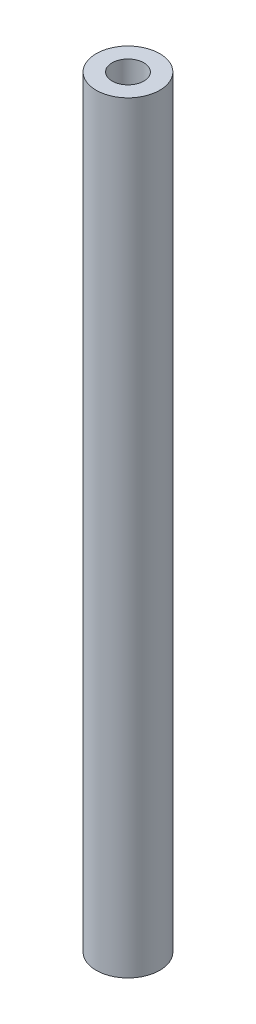
from build123d import *

# Parameters (mm, degrees)
CROQUIS_BASE_R          = 2.5
SALIENTE_EXTRUIR1_DEPTH = 60
CROQUIS_BARRENO_R       = 1.25
CORTAR_EXTRUIR1_DEPTH   = 61.104076401


with BuildPart() as part:
    # Croquis base → Saliente-Extruir1 (new body)
    with BuildSketch(Plane(origin=(0, 0, 0), x_dir=(1, 0, 0), z_dir=(0, 1, 0))):
        with Locations(Location((0, 0, 0), (0, 0, 270))):
            Circle(CROQUIS_BASE_R)
    extrude(amount=SALIENTE_EXTRUIR1_DEPTH)

    # Croquis barreno → Cortar-Extruir1 (cut, through all)
    with BuildSketch(Plane(origin=(0, 60, 0), x_dir=(1, 0, 0), z_dir=(0, 1, 0))):
        with Locations(Location((0, 0, 0), (0, 0, 270))):
            Circle(CROQUIS_BARRENO_R)
    extrude(amount=-CORTAR_EXTRUIR1_DEPTH, mode=Mode.SUBTRACT)


solid = part.part
